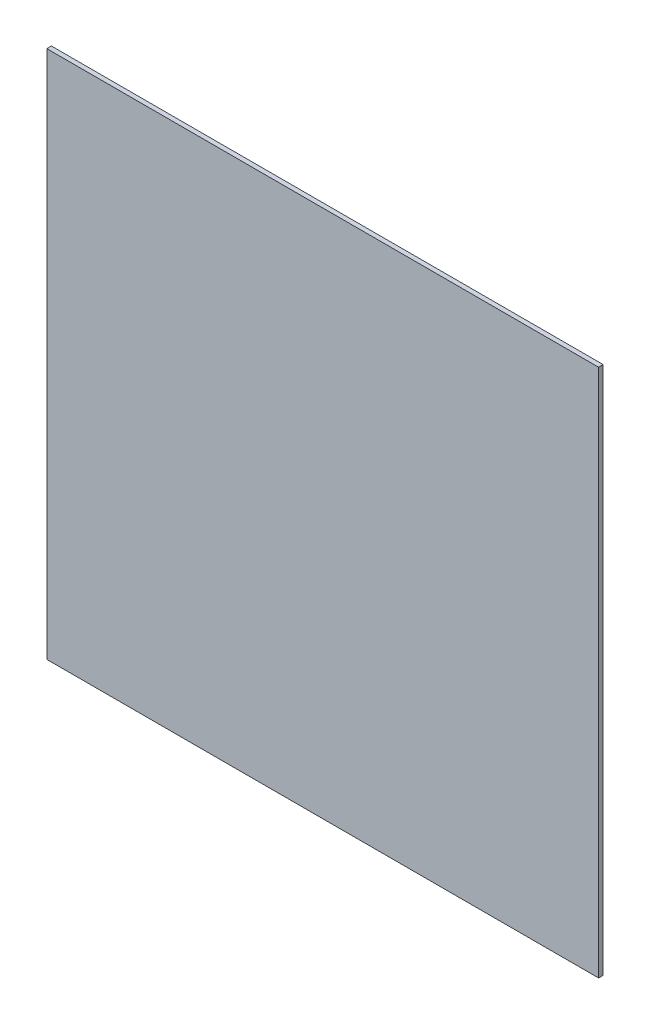
from build123d import *

# Parameters (mm, degrees)
ESQUISSE1_W        = 605
ESQUISSE1_H        = 580
BOSS_EXTRU_1_DEPTH = 5


with BuildPart() as part:
    # Esquisse1 → Boss.-Extru.1 (new body)
    with BuildSketch(Plane.XY):
        Rectangle(ESQUISSE1_W, ESQUISSE1_H)
    extrude(amount=BOSS_EXTRU_1_DEPTH)


solid = part.part
